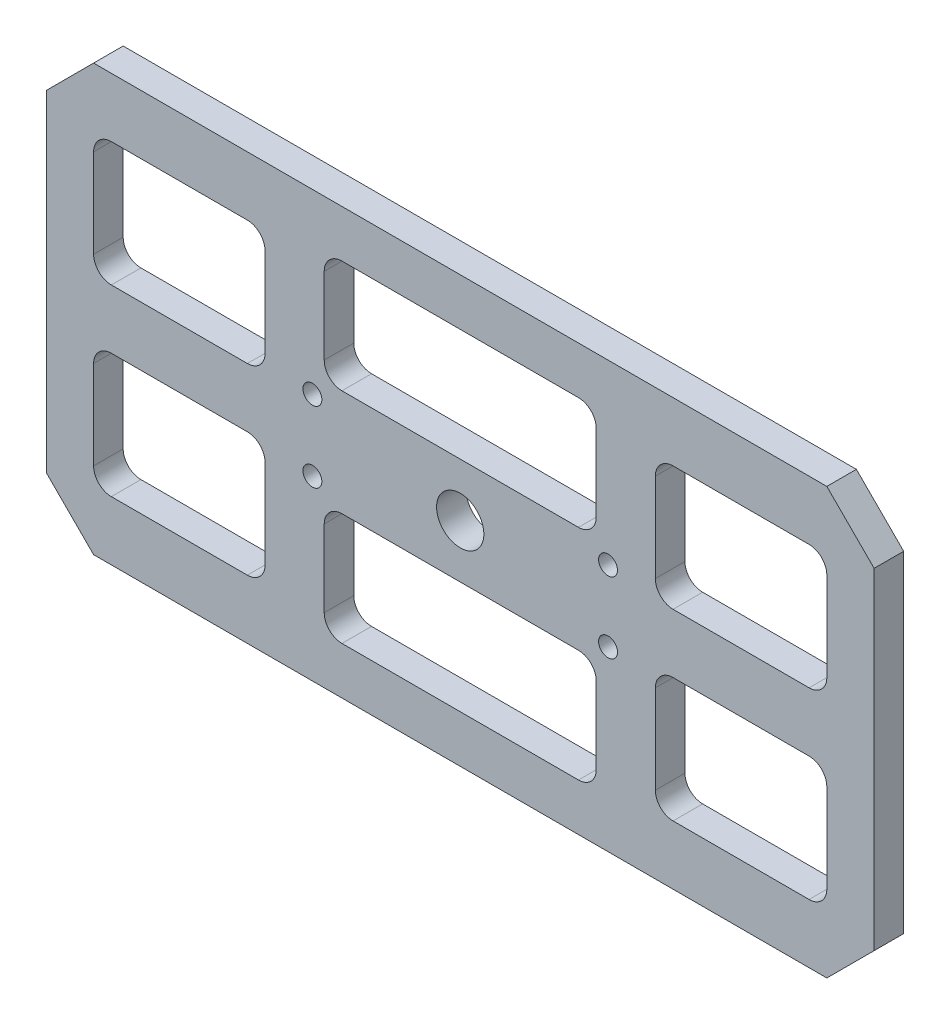
from build123d import *

# Parameters (mm, degrees)
SKETCH_1_W          = 140
SKETCH_1_H          = 72
SKETCH_1_R          = 1.6
SKETCH_1_R_2        = 4
EXTRUDE_1_DEPTH     = 5
SKETCH_2_W          = 29
SKETCH_2_H          = 21
SKETCH_2_W_2        = 46
SKETCH_2_H_2        = 19
CUT_EXTRUDE_1_DEPTH = 79.873316147
FILLET_1_R          = 3
CHAMFER_1_SIZE      = 8


with BuildPart() as part:
    # 草图1 → 凸台-拉伸1 (new body)
    with BuildSketch(Plane.XY):
        Rectangle(SKETCH_1_W, SKETCH_1_H)
        with Locations((-25, 6)):
            Circle(SKETCH_1_R, mode=Mode.SUBTRACT)
        with Locations((25, 6)):
            Circle(SKETCH_1_R, mode=Mode.SUBTRACT)
        with Locations((-25, -6)):
            Circle(SKETCH_1_R, mode=Mode.SUBTRACT)
        with Locations((25, -6)):
            Circle(SKETCH_1_R, mode=Mode.SUBTRACT)
        Circle(SKETCH_1_R_2, mode=Mode.SUBTRACT)
    extrude(amount=EXTRUDE_1_DEPTH)

    # 草图2 → 切除-拉伸1 (cut, through all)
    with BuildSketch(Plane.XY.offset(5)):
        with Locations((-47.5, 15.5)):
            Rectangle(SKETCH_2_W, SKETCH_2_H)
        with Locations((-47.5, -15.5)):
            Rectangle(SKETCH_2_W, SKETCH_2_H)
        with Locations((47.5, -15.5)):
            Rectangle(SKETCH_2_W, SKETCH_2_H)
        with Locations((47.5, 15.5)):
            Rectangle(SKETCH_2_W, SKETCH_2_H)
        with Locations((0, 18.5)):
            Rectangle(SKETCH_2_W_2, SKETCH_2_H_2)
        with Locations((0, -18.5)):
            Rectangle(SKETCH_2_W_2, SKETCH_2_H_2)
    extrude(amount=-CUT_EXTRUDE_1_DEPTH, mode=Mode.SUBTRACT)

    # 圆角1
    fillet_1_edges = [part.edges().sort_by_distance(p)[0] for p in [
        (-62, -26, 2.5),
        (-62, -5, 2.5),
        (-33, -5, 2.5),
        (-33, -26, 2.5),
        (23, 28, 2.5),
        (23, 9, 2.5),
        (-23, 9, 2.5),
        (-23, 28, 2.5),
        (62, -5, 2.5),
        (62, -26, 2.5),
        (33, -26, 2.5),
        (33, -5, 2.5),
        (62, 26, 2.5),
        (62, 5, 2.5),
        (33, 5, 2.5),
        (33, 26, 2.5),
        (23, -9, 2.5),
        (23, -28, 2.5),
        (-23, -28, 2.5),
        (-23, -9, 2.5),
        (-62, 5, 2.5),
        (-62, 26, 2.5),
        (-33, 26, 2.5),
        (-33, 5, 2.5),
    ]]
    fillet(fillet_1_edges, radius=FILLET_1_R)

    # 倒角1
    chamfer_1_edges = [part.edges().sort_by_distance(p)[0] for p in [
        (-70, 36, 2.5),
        (70, 36, 2.5),
        (70, -36, 2.5),
        (-70, -36, 2.5),
    ]]
    chamfer(chamfer_1_edges, length=CHAMFER_1_SIZE)


solid = part.part
